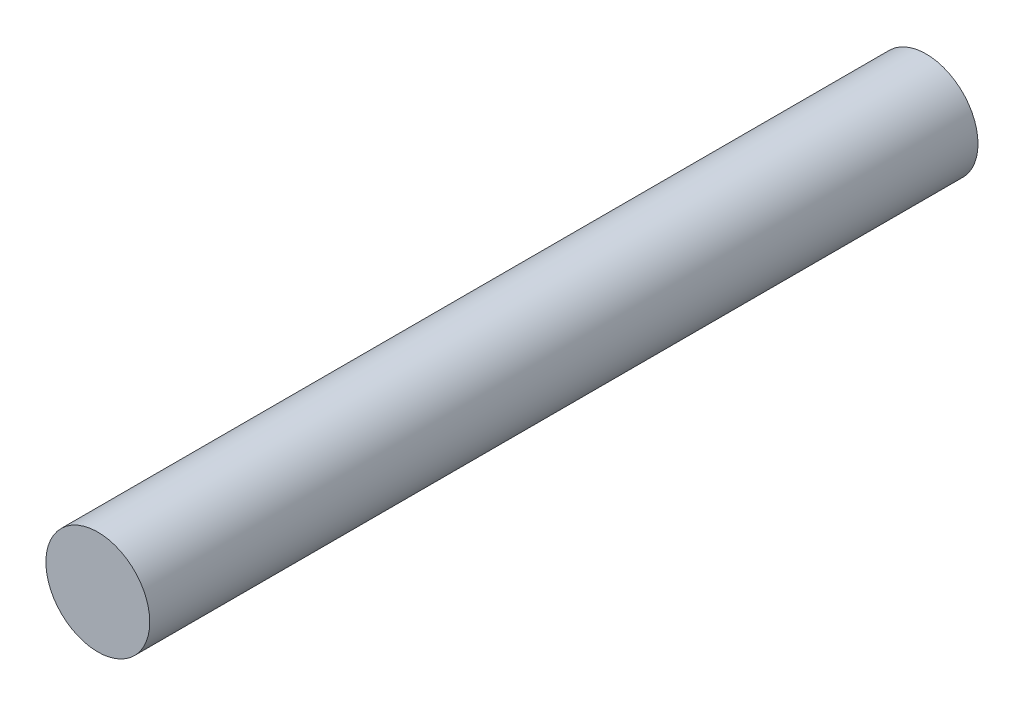
from build123d import *

# Parameters (mm, degrees)
SKETCH_1_R      = 1
EXTRUDE_1_DEPTH = 15.95


with BuildPart() as part:
    # 草图1 → 凸台-拉伸1 (new body)
    with BuildSketch(Plane.XY):
        Circle(SKETCH_1_R)
    extrude(amount=EXTRUDE_1_DEPTH)


solid = part.part
